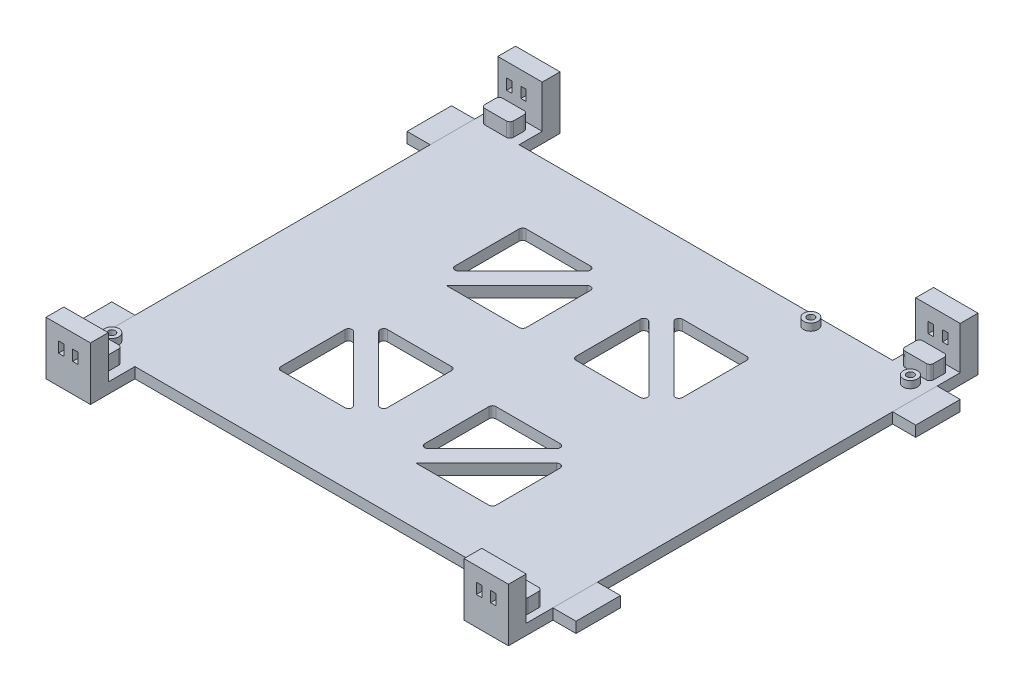
from build123d import *

# Parameters (mm, degrees)
SKETCH1_W             = 130
SKETCH1_H             = 108
SKETCH1_R             = 2
SKETCH1_R_2           = 1
SKETCH1_W_2           = 12.5
SKETCH1_H_2           = 11.5
SKETCH1_H_3           = 12.5
BOSS_EXTRUDE2_DEPTH   = 3
SKETCH3_R             = 2
SKETCH3_R_2           = 1
BOSS_EXTRUDE3_DEPTH   = 2
SKETCH5_W             = 12.5
SKETCH5_H             = 5
BOSS_EXTRUDE4_DEPTH   = 12
SKETCH6_W             = 1.5
SKETCH6_H             = 3
CUT_EXTRUDE1_DEPTH    = 5
SKETCH7_W             = 1.5
SKETCH7_H             = 3
CUT_EXTRUDE2_DEPTH    = 5
SKETCH8_W             = 8
SKETCH8_H             = 5
BOSS_EXTRUDE5_DEPTH   = 4
SKETCH9_W             = 6.5
SKETCH9_H             = 12.5
BOSS_EXTRUDE6_DEPTH   = 3
BOSS_EXTRUDE6_2_DEPTH = 3
BOSS_EXTRUDE6_3_DEPTH = 3
BOSS_EXTRUDE6_4_DEPTH = 3
CUT_EXTRUDE3_DEPTH    = 3
FILLET1_R             = 1


with BuildPart() as part:
    # Sketch1 → Boss-Extrude2 (new body)
    # profile 1 of 8: a face of its own
    with BuildSketch(Plane(origin=(0, 0, 0), x_dir=(1, 0, 0), z_dir=(0, 1, 0))):
        with Locations((65, 54)):
            Rectangle(SKETCH1_W, SKETCH1_H)
        with Locations((125.5, 105)):
            Circle(SKETCH1_R, mode=Mode.SUBTRACT)
        with Locations((97.5, 105)):
            Circle(SKETCH1_R, mode=Mode.SUBTRACT)
        with Locations((3, 3)):
            Circle(SKETCH1_R, mode=Mode.SUBTRACT)
    # profile 2 of 8: a face of its own
    with BuildSketch(Plane(origin=(0, 0, 0), x_dir=(1, 0, 0), z_dir=(0, 1, 0))):
        with Locations((3, 3)):
            Circle(SKETCH1_R)
        with Locations(Location((3, 3, 0), (0, 0, 270))):
            Circle(SKETCH1_R_2, mode=Mode.SUBTRACT)
    # profile 3 of 8: a face of its own
    with BuildSketch(Plane(origin=(0, 0, 0), x_dir=(1, 0, 0), z_dir=(0, 1, 0))):
        with Locations((125.5, 105)):
            Circle(SKETCH1_R)
        with Locations(Location((125.5, 105, 0), (0, 0, 270))):
            Circle(SKETCH1_R_2, mode=Mode.SUBTRACT)
    # profile 4 of 8: a face of its own
    with BuildSketch(Plane(origin=(0, 0, 0), x_dir=(1, 0, 0), z_dir=(0, 1, 0))):
        with Locations((97.5, 105)):
            Circle(SKETCH1_R)
        with Locations(Location((97.5, 105, 0), (0, 0, 270))):
            Circle(SKETCH1_R_2, mode=Mode.SUBTRACT)
    # profile 5 of 8: a face of its own
    with BuildSketch(Plane(origin=(0, 0, 0), x_dir=(1, 0, 0), z_dir=(0, 1, 0))):
        with Locations((6.25, 113.75)):
            Rectangle(SKETCH1_W_2, SKETCH1_H_2)
    # profile 6 of 8: a face of its own
    with BuildSketch(Plane(origin=(0, 0, 0), x_dir=(1, 0, 0), z_dir=(0, 1, 0))):
        with Locations((123.75, 113.75)):
            Rectangle(SKETCH1_W_2, SKETCH1_H_2)
    # profile 7 of 8: a face of its own
    with BuildSketch(Plane(origin=(0, 0, 0), x_dir=(1, 0, 0), z_dir=(0, 1, 0))):
        with Locations((123.75, -6.25)):
            Rectangle(SKETCH1_W_2, SKETCH1_H_3)
    # profile 8 of 8: a face of its own
    with BuildSketch(Plane(origin=(0, 0, 0), x_dir=(1, 0, 0), z_dir=(0, 1, 0))):
        with Locations((6.25, -6.25)):
            Rectangle(SKETCH1_W_2, SKETCH1_H_3)
    extrude(amount=BOSS_EXTRUDE2_DEPTH)

    # Sketch3 → Boss-Extrude3 (add)
    # profile 1 of 3: a face of its own
    with BuildSketch(Plane(origin=(0, 3, 0), x_dir=(1, 0, 0), z_dir=(0, 1, 0))):
        with Locations(Location((3, 3, 0), (0, 0, 270))):
            Circle(SKETCH3_R)
        with Locations(Location((3, 3, 0), (0, 0, 270))):
            Circle(SKETCH3_R_2, mode=Mode.SUBTRACT)
    # profile 2 of 3: a face of its own
    with BuildSketch(Plane(origin=(0, 3, 0), x_dir=(1, 0, 0), z_dir=(0, 1, 0))):
        with Locations(Location((97.5, 105, 0), (0, 0, 270))):
            Circle(SKETCH3_R)
        with Locations(Location((97.5, 105, 0), (0, 0, 270))):
            Circle(SKETCH3_R_2, mode=Mode.SUBTRACT)
    # profile 3 of 3: a face of its own
    with BuildSketch(Plane(origin=(0, 3, 0), x_dir=(1, 0, 0), z_dir=(0, 1, 0))):
        with Locations(Location((125.5, 105, 0), (0, 0, 270))):
            Circle(SKETCH3_R)
        with Locations(Location((125.5, 105, 0), (0, 0, 270))):
            Circle(SKETCH3_R_2, mode=Mode.SUBTRACT)
    extrude(amount=BOSS_EXTRUDE3_DEPTH)

    # Sketch5 → Boss-Extrude4 (add)
    with BuildSketch(Plane(origin=(0, 3, 0), x_dir=(1, 0, 0), z_dir=(0, 1, 0))):
        with Locations((6.25, -10)):
            Rectangle(SKETCH5_W, SKETCH5_H)
        with Locations((123.75, -10)):
            Rectangle(SKETCH5_W, SKETCH5_H)
        with Locations((6.25, 117)):
            Rectangle(SKETCH5_W, SKETCH5_H)
        with Locations((123.75, 117)):
            Rectangle(SKETCH5_W, SKETCH5_H)
    extrude(amount=BOSS_EXTRUDE4_DEPTH)

    # Sketch6 → Cut-Extrude1 (cut)
    with BuildSketch(Plane.XY.offset(12.5)):
        with Locations((8.25, 9.5)):
            Rectangle(SKETCH6_W, SKETCH6_H)
        with Locations((125.75, 9.5)):
            Rectangle(SKETCH6_W, SKETCH6_H)
        with Locations((121.75, 9.5)):
            Rectangle(SKETCH6_W, SKETCH6_H)
        with Locations((4.25, 9.5)):
            Rectangle(SKETCH6_W, SKETCH6_H)
    extrude(amount=-CUT_EXTRUDE1_DEPTH, mode=Mode.SUBTRACT)

    # Sketch7 → Cut-Extrude2 (cut)
    with BuildSketch(Plane(origin=(0, 0, -119.5), x_dir=(-1, 0, 0), z_dir=(0, 0, -1))):
        with Locations((-125.75, 9.5)):
            Rectangle(SKETCH7_W, SKETCH7_H)
        with Locations((-121.75, 9.5)):
            Rectangle(SKETCH7_W, SKETCH7_H)
        with Locations((-3.25, 9.5)):
            Rectangle(SKETCH7_W, SKETCH7_H)
        with Locations((-7.25, 9.5)):
            Rectangle(SKETCH7_W, SKETCH7_H)
    extrude(amount=-CUT_EXTRUDE2_DEPTH, mode=Mode.SUBTRACT)

    # Sketch8 → Boss-Extrude5 (add)
    with BuildSketch(Plane(origin=(0, 3, 0), x_dir=(1, 0, 0), z_dir=(0, 1, 0))):
        with Locations((5.903875203, 110.5)):
            Rectangle(SKETCH8_W, SKETCH8_H)
        with Locations((123.995366617, 110.5)):
            Rectangle(SKETCH8_W, SKETCH8_H)
        with Locations((123.995366617, -3.5)):
            Rectangle(SKETCH8_W, SKETCH8_H)
        with Locations((5.903875203, -3.5)):
            Rectangle(SKETCH8_W, SKETCH8_H)
    extrude(amount=BOSS_EXTRUDE5_DEPTH)

    # Sketch10 → Cut-Extrude3 (cut)
    with BuildSketch(Plane(origin=(0, 3, 0), x_dir=(1, 0, 0), z_dir=(0, 1, 0))):
        Polygon((97, 37.464466094), (75.535533906, 16), (97, 16), align=None)
        Polygon((72, 41), (72, 19.535533906), (93.464466094, 41), align=None)
        Polygon((93.464466094, 63.5), (72, 84.964466094), (72, 63.5), align=None)
        Polygon((97, 88.5), (75.535533906, 88.5), (97, 67.035533906), align=None)
        Polygon((36.535533906, 44.5), (58, 23.035533906), (58, 44.5), align=None)
        Polygon((58, 63.5), (58, 84.964466094), (36.535533906, 63.5), align=None)
        Polygon((33, 67.035533906), (54.464466094, 88.5), (33, 88.5), align=None)
        Polygon((33, 19.5), (54.464466094, 19.5), (33, 40.964466094), align=None)
    extrude(amount=-CUT_EXTRUDE3_DEPTH, mode=Mode.SUBTRACT)

    # Fillet1
    fillet1_edges = [part.edges().sort_by_distance(p)[0] for p in [
        (9.903875203, 5, -108),
        (9.903875203, 5, -113),
        (1.903875203, 5, -113),
        (1.903875203, 5, -108),
        (127.995366617, 5, -108),
        (127.995366617, 5, -113),
        (119.995366617, 5, -113),
        (119.995366617, 5, -108),
        (127.995366617, 5, 6),
        (127.995366617, 5, 1),
        (119.995366617, 5, 1),
        (119.995366617, 5, 6),
        (1.903875203, 5, 1),
        (1.903875203, 5, 6),
        (9.903875203, 5, 6),
        (9.903875203, 5, 1),
        (36.535533906, 1.5, -44.5),
        (58, 1.5, -44.5),
        (58, 1.5, -23.035533906),
        (97, 1.5, -67.035533906),
        (75.535533906, 1.5, -88.5),
        (97, 1.5, -88.5),
        (93.464466094, 1.5, -63.5),
        (72, 1.5, -63.5),
        (72, 1.5, -84.964466094),
        (72, 1.5, -19.535533906),
        (72, 1.5, -41),
        (93.464466094, 1.5, -41),
        (33, 1.5, -67.035533906),
        (33, 1.5, -88.5),
        (54.464466094, 1.5, -88.5),
        (58, 1.5, -84.964466094),
        (58, 1.5, -63.5),
        (33, 1.5, -40.964466094),
        (54.464466094, 1.5, -19.5),
        (33, 1.5, -19.5),
        (97, 1.5, -37.464466094),
        (97, 1.5, -16),
    ]]
    fillet(fillet1_edges, radius=FILLET1_R)


with BuildPart() as body_2:
    # Sketch9 → Boss-Extrude6 (new body)
    with BuildSketch(Plane(origin=(0, 3, 0), x_dir=(1, 0, 0), z_dir=(0, 1, 0))):
        with Locations((133.25, 6.25)):
            Rectangle(SKETCH9_W, SKETCH9_H)
    extrude(amount=-BOSS_EXTRUDE6_DEPTH)


with BuildPart() as body_3:
    # Sketch9 → Boss-Extrude6 2 (new body)
    with BuildSketch(Plane(origin=(0, 3, 0), x_dir=(1, 0, 0), z_dir=(0, 1, 0))):
        with Locations((133.25, 101.75)):
            Rectangle(SKETCH9_W, SKETCH9_H)
    extrude(amount=-BOSS_EXTRUDE6_2_DEPTH)


with BuildPart() as body_4:
    # Sketch9 → Boss-Extrude6 3 (new body)
    with BuildSketch(Plane(origin=(0, 3, 0), x_dir=(1, 0, 0), z_dir=(0, 1, 0))):
        with Locations((-3.25, 6.25)):
            Rectangle(SKETCH9_W, SKETCH9_H)
    extrude(amount=-BOSS_EXTRUDE6_3_DEPTH)


with BuildPart() as body_5:
    # Sketch9 → Boss-Extrude6 4 (new body)
    with BuildSketch(Plane(origin=(0, 3, 0), x_dir=(1, 0, 0), z_dir=(0, 1, 0))):
        with Locations((-3.25, 101.75)):
            Rectangle(SKETCH9_W, SKETCH9_H)
    extrude(amount=-BOSS_EXTRUDE6_4_DEPTH)


solid = Compound([part.part, body_2.part, body_3.part, body_4.part, body_5.part])
